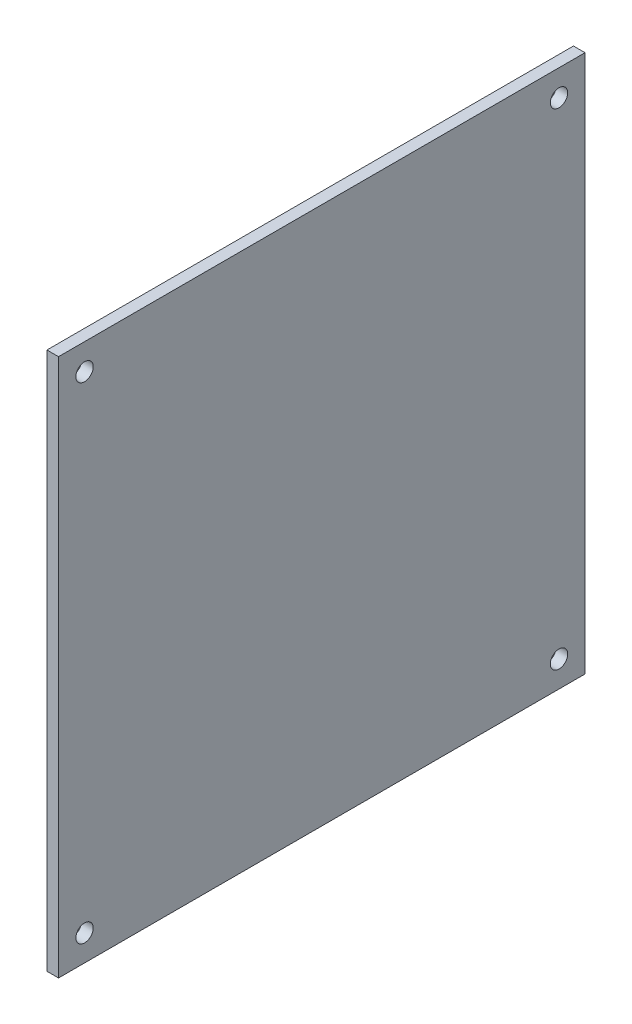
from build123d import *

# Parameters (mm, degrees)
SKETCH_1_W      = 91
SKETCH_1_H      = 93
SKETCH_1_R      = 1.5
EXTRUDE_1_DEPTH = 2


with BuildPart() as part:
    # Эскиз1 → Бобышка-Вытянуть1 (new body)
    with BuildSketch(Plane(origin=(0, 0, 0), x_dir=(0, 0, -1), z_dir=(1, 0, 0))):
        with Locations((14.629493357, 3.197856898)):
            Rectangle(SKETCH_1_W, SKETCH_1_H)
        with Locations((-26.370506643, 45.197856898)):
            Circle(SKETCH_1_R, mode=Mode.SUBTRACT)
        with Locations(Location((55.629493357, 45.197856898, 0), (0, 0, 180))):
            Circle(SKETCH_1_R, mode=Mode.SUBTRACT)
        with Locations((55.629493357, -38.802143102)):
            Circle(SKETCH_1_R, mode=Mode.SUBTRACT)
        with Locations(Location((-26.370506643, -38.802143102, 0), (0, 0, 180))):
            Circle(SKETCH_1_R, mode=Mode.SUBTRACT)
    extrude(amount=EXTRUDE_1_DEPTH)


solid = part.part
